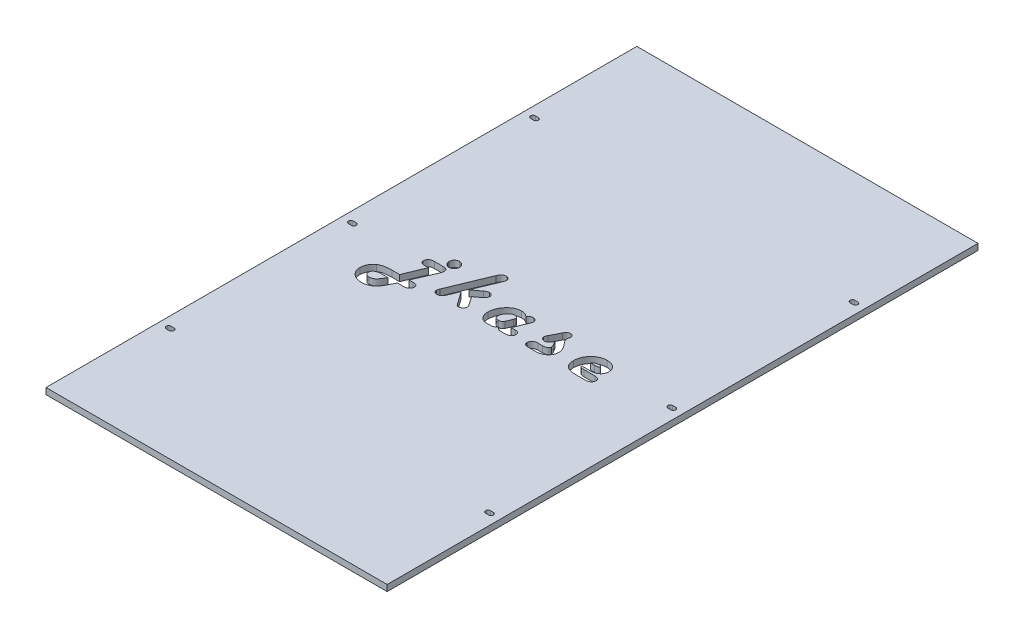
from build123d import *

# Parameters (mm, degrees)
SKETCH_1_W              = 220
SKETCH_1_H              = 381
EXTRUDE_1_DEPTH         = 4
HOLE_WIZARD_2_9_2_9_1_D = 2.9
CUT_EXTRUDE_3_DEPTH     = 225.945898173
CUT_EXTRUDE_4_DEPTH     = 225.945898311


with BuildPart() as part:
    # 草圖1 → 填料-伸長1 (new body)
    with BuildSketch(Plane(origin=(0, 0, 0), x_dir=(1, 0, 0), z_dir=(0, 1, 0))):
        with Locations((-3.755314961, 3.521610711)):
            Rectangle(SKETCH_1_W, SKETCH_1_H)
    extrude(amount=-EXTRUDE_1_DEPTH)

    # Ø2.9 (2.9) 直徑孔1 (through all)
    with Locations(Plane(origin=(-106.755314961, 0, -121.021610711), x_dir=(0, 0, 1), z_dir=(0, 1, 0))):
        with Locations((0, 0), (117.5, 0), (235, 0), (235, 206), (117.5, 206), (0, 206)):
            Hole(HOLE_WIZARD_2_9_2_9_1_D / 2)

    # 草圖6 → 除料-伸長3 (cut, through all)
    # profile 1 of 6: a face of its own
    with BuildSketch(Plane(origin=(0, 0, 0), x_dir=(1, 0, 0), z_dir=(0, 1, 0))):
        with BuildLine():
            Line((-56.707883455, -9.882498878), (-54.080314961, -9.882498878))
            add(Edge.make_bspline(
                [(-54.080314961, -9.882498878), (-53.846803536, -9.888460143), (-53.405322462, -9.899730623), (-52.791394229, -10.003113139), (-52.2675506, -10.172191342), (-51.829005076, -10.408457443), (-51.497746899, -10.740338804), (-51.246306857, -11.12720908), (-51.113141152, -11.595486832), (-51.09504868, -11.925398642), (-51.085451948, -12.100392714)],
                knots=[0, 0, 0, 0, 1.320440897, 2.496450283, 3.507428571, 4.426081598, 5.28328365, 6.133314078, 7.00985972, 8, 8, 8, 8], degree=3))
            add(Edge.make_bspline(
                [(-51.085451948, -12.100392714), (-51.096078388, -12.337305993), (-51.116579449, -12.794370941), (-51.31951434, -13.440270308), (-51.664616797, -14.00189006), (-52.135919876, -14.477306248), (-52.72884569, -14.857167097), (-53.430876539, -15.122864276), (-54.238585193, -15.27605282), (-54.809494192, -15.296393865), (-55.111564961, -15.307156412)],
                knots=[0, 0, 0, 0, 0.975863685, 1.882685037, 2.759476257, 3.673560596, 4.622529859, 5.644125856, 6.753495364, 8, 8, 8, 8], degree=3))
            Line((-55.111564961, -15.307156412), (-58.826890304, -15.307156412))
            Line((-58.826890304, -15.307156412), (-60.536222496, -18.690504015))
            Line((-60.536222496, -18.690504015), (-61.235494756, -20.08198518))
            add(Edge.make_bspline(
                [(-61.235494756, -20.08198518), (-61.373677856, -20.347397447), (-61.645594273, -20.869675153), (-62.098440226, -21.608918538), (-62.57288592, -22.297156683), (-63.068040173, -22.93392772), (-63.58339549, -23.524944882), (-64.128803742, -24.057626274), (-64.685515384, -24.552582027), (-65.275570331, -24.981539696), (-65.883717001, -25.365380339), (-66.514604477, -25.6972031), (-67.166306364, -25.985036149), (-67.847805041, -26.205257232), (-68.546389878, -26.39388346), (-69.26971669, -26.520037031), (-70.013892883, -26.58900615), (-70.516608631, -26.601966988), (-70.771025578, -26.608526275)],
                knots=[0, 0, 0, 0, 1.173928715, 2.310054478, 3.399266196, 4.452701399, 5.47396114, 6.473551042, 7.44265858, 8.394344937, 9.332571238, 10.262481144, 11.189356778, 12.124301921, 13.070004608, 14.026968462, 15.00147815, 16, 16, 16, 16], degree=3))
            add(Edge.make_bspline(
                [(-70.771025578, -26.608526275), (-71.077434087, -26.602089685), (-71.678022298, -26.58947339), (-72.55939026, -26.480017179), (-73.401556858, -26.305992848), (-74.205087801, -26.056163693), (-74.973971692, -25.739449149), (-75.700444469, -25.338732734), (-76.397073185, -24.881230714), (-77.043838304, -24.351697497), (-77.633163068, -23.770384898), (-78.153146042, -23.148508164), (-78.58742741, -22.486157125), (-78.93891688, -21.78991513), (-79.229509075, -21.064685468), (-79.424245706, -20.300044393), (-79.538433266, -19.499176806), (-79.555953783, -18.954580208), (-79.564904002, -18.676377303)],
                knots=[0, 0, 0, 0, 1.112220966, 2.18005303, 3.219619084, 4.230960223, 5.231219529, 6.233522715, 7.23888393, 8.25365207, 9.26322105, 10.240715656, 11.191564732, 12.132134891, 13.068811624, 14.022653815, 14.989888192, 16, 16, 16, 16], degree=3))
            add(Edge.make_bspline(
                [(-79.564904002, -18.676377303), (-79.551964535, -18.345951882), (-79.525982135, -17.682458933), (-79.33594934, -16.694712429), (-79.021662069, -15.718103744), (-78.583393185, -14.769266558), (-78.058609389, -13.866444494), (-77.435605138, -13.052041346), (-76.738409567, -12.331336262), (-76.210549284, -11.931578623), (-75.948465646, -11.733098193)],
                knots=[0, 0, 0, 0, 0.976706833, 1.96122349, 2.963017113, 4.003613299, 5.04600127, 6.044402259, 7.029041992, 8, 8, 8, 8], degree=3))
            add(Edge.make_bspline(
                [(-75.948465646, -11.733098193), (-75.715855366, -11.584543192), (-75.234543655, -11.277156683), (-74.431028686, -10.89843597), (-73.537151114, -10.585157246), (-72.557935218, -10.321121141), (-71.486516214, -10.131141317), (-70.327361165, -9.979715505), (-69.076990816, -9.898246966), (-68.214195323, -9.8878582), (-67.769099208, -9.882498878)],
                knots=[0, 0, 0, 0, 0.778053811, 1.609930613, 2.498631059, 3.447639707, 4.467720787, 5.565947943, 6.744329191, 8, 8, 8, 8], degree=3))
            Line((-67.769099208, -9.882498878), (-62.810623181, -9.882498878))
            Line((-62.810623181, -9.882498878), (-57.400092359, 3.227090163))
            Line((-57.400092359, 3.227090163), (-59.971154002, 3.227090163))
            add(Edge.make_bspline(
                [(-59.971154002, 3.227090163), (-60.19537031, 3.232838927), (-60.618379044, 3.243684603), (-61.205407651, 3.349443603), (-61.710801774, 3.513769097), (-62.120638997, 3.766626746), (-62.4526551, 4.082355204), (-62.681437787, 4.476857816), (-62.821001246, 4.938960787), (-62.832683469, 5.26966607), (-62.838876605, 5.444983998)],
                knots=[0, 0, 0, 0, 1.300564961, 2.453658901, 3.45240791, 4.366849035, 5.227268409, 6.085403913, 6.985008596, 8, 8, 8, 8], degree=3))
            add(Edge.make_bspline(
                [(-62.838876605, 5.444983998), (-62.827656622, 5.684119008), (-62.806039611, 6.1448491), (-62.612842862, 6.794248277), (-62.284226962, 7.357472653), (-61.829542444, 7.82753243), (-61.262085375, 8.21124101), (-60.575959757, 8.462815331), (-59.795757756, 8.632346571), (-59.239960793, 8.645050634), (-58.946967359, 8.651747697)],
                knots=[0, 0, 0, 0, 1.00337913, 1.933163031, 2.815671856, 3.718527641, 4.659876397, 5.668705541, 6.771036881, 8, 8, 8, 8], degree=3))
            Line((-58.946967359, 8.651747697), (-53.246838934, 8.651747697))
            add(Edge.make_bspline(
                [(-53.246838934, 8.651747697), (-53.006265612, 8.646367101), (-52.554989093, 8.636273976), (-51.924392199, 8.526813509), (-51.390385027, 8.333037773), (-50.939389373, 8.077402883), (-50.594662806, 7.722471833), (-50.349997918, 7.295407538), (-50.207013744, 6.791125724), (-50.190211126, 6.432456331), (-50.181342359, 6.243143245)],
                knots=[0, 0, 0, 0, 1.296879226, 2.432735008, 3.433078365, 4.349978554, 5.203100014, 6.067862313, 6.980177973, 8, 8, 8, 8], degree=3))
            add(Edge.make_bspline(
                [(-50.181342359, 6.243143245), (-50.189800752, 6.082699819), (-50.207457506, 5.747776847), (-50.303686189, 5.226268331), (-50.466623754, 4.670926976), (-50.618216377, 4.297130288), (-50.696967359, 4.102946327)],
                knots=[0, 0, 0, 0, 0.869779632, 1.815650453, 2.865250387, 4, 4, 4, 4], degree=3))
            Line((-50.696967359, 4.102946327), (-56.707883455, -9.882498878))
        make_face()
        with BuildLine():
            Line((-64.92963003, -15.307156412), (-68.270597496, -15.307156412))
            add(Edge.make_bspline(
                [(-68.270597496, -15.307156412), (-68.508397548, -15.310651611), (-68.967785893, -15.317403726), (-69.633313782, -15.346871955), (-70.252115541, -15.423561955), (-70.826804183, -15.507886033), (-71.353632667, -15.632841028), (-71.838735538, -15.76831221), (-72.273919274, -15.94690334), (-72.668489337, -16.143953287), (-73.014426171, -16.369268983), (-73.316503408, -16.619478638), (-73.574437143, -16.894899485), (-73.780081284, -17.204277887), (-73.946363589, -17.537766057), (-74.055226717, -17.901246518), (-74.131305435, -18.287082805), (-74.137211082, -18.553546791), (-74.140246468, -18.690504015)],
                knots=[0, 0, 0, 0, 1.499319777, 2.896425055, 4.196166997, 5.428397356, 6.555302654, 7.607295001, 8.599480653, 9.515475966, 10.384072422, 11.195501791, 11.983238689, 12.75301387, 13.529626568, 14.322936488, 15.138022488, 16, 16, 16, 16], degree=3))
            add(Edge.make_bspline(
                [(-74.140246468, -18.690504015), (-74.131003719, -18.865699472), (-74.112911347, -19.208638709), (-73.962898326, -19.70005514), (-73.697919379, -20.131372485), (-73.350140143, -20.509241977), (-72.91890562, -20.813023447), (-72.419175743, -21.022906158), (-71.86660208, -21.165212141), (-71.475977575, -21.177479424), (-71.272523865, -21.183868741)],
                knots=[0, 0, 0, 0, 0.986072637, 1.930204145, 2.858450967, 3.816001337, 4.806081511, 5.804216648, 6.856343462, 8, 8, 8, 8], degree=3))
            add(Edge.make_bspline(
                [(-71.272523865, -21.183868741), (-70.976403709, -21.170351611), (-70.387568059, -21.143472766), (-69.538565444, -20.88344272), (-68.742762449, -20.470447742), (-68.133226609, -19.994963375), (-67.66076104, -19.530330686), (-67.294327953, -19.111133462), (-66.919809849, -18.629743219), (-66.542475031, -18.083112263), (-66.141570961, -17.482523691), (-65.745163649, -16.811854635), (-65.332222672, -16.083474765), (-65.066856501, -15.571769862), (-64.92963003, -15.307156412)],
                knots=[0, 0, 0, 0, 1.165182134, 2.316967503, 3.467367141, 4.685724863, 5.348912398, 6.079174134, 6.87972837, 7.75301661, 8.698185743, 9.726916567, 10.824540386, 12, 12, 12, 12], degree=3))
        make_face(mode=Mode.SUBTRACT)
    # profile 2 of 6: a face of its own
    with BuildSketch(Plane(origin=(0, 0, 0), x_dir=(1, 0, 0), z_dir=(0, 1, 0))):
        with BuildLine():
            add(Edge.make_bspline(
                [(-50.85942455, 16.788733998), (-50.632184176, 16.776421407), (-50.186425637, 16.752268821), (-49.544250105, 16.563920937), (-48.961770875, 16.242801426), (-48.442344395, 15.815403195), (-48.014946164, 15.295976715), (-47.693826653, 14.713497485), (-47.505478769, 14.071321953), (-47.481326183, 13.625563414), (-47.469013592, 13.39832304)],
                knots=[0, 0, 0, 0, 1.022434278, 2.00562427, 2.98307932, 4, 5.01692068, 5.99437573, 6.977565722, 8, 8, 8, 8], degree=3))
            add(Edge.make_bspline(
                [(-47.469013592, 13.39832304), (-47.481326183, 13.171082665), (-47.505478769, 12.725324126), (-47.693826653, 12.083148594), (-48.014946164, 11.500669364), (-48.442344395, 10.981242884), (-48.961770875, 10.553844654), (-49.544250105, 10.232725142), (-50.186425637, 10.044377258), (-50.632184176, 10.020224672), (-50.85942455, 10.007912081)],
                knots=[0, 0, 0, 0, 1.022434278, 2.00562427, 2.98307932, 4, 5.01692068, 5.99437573, 6.977565722, 8, 8, 8, 8], degree=3))
            add(Edge.make_bspline(
                [(-50.85942455, 10.007912081), (-51.086664925, 10.020224672), (-51.532423464, 10.044377258), (-52.174598996, 10.232725142), (-52.757078226, 10.553844654), (-53.276504706, 10.981242884), (-53.703902936, 11.500669364), (-54.025022448, 12.083148594), (-54.213370332, 12.725324126), (-54.237522918, 13.171082665), (-54.249835509, 13.39832304)],
                knots=[0, 0, 0, 0, 1.022434278, 2.00562427, 2.98307932, 4, 5.01692068, 5.99437573, 6.977565722, 8, 8, 8, 8], degree=3))
            add(Edge.make_bspline(
                [(-54.249835509, 13.39832304), (-54.237522918, 13.625563414), (-54.213370332, 14.071321953), (-54.025022448, 14.713497485), (-53.703902936, 15.295976715), (-53.276504706, 15.815403195), (-52.757078226, 16.242801426), (-52.174598996, 16.563920937), (-51.532423464, 16.752268821), (-51.086664925, 16.776421407), (-50.85942455, 16.788733998)],
                knots=[0, 0, 0, 0, 1.022434278, 2.00562427, 2.98307932, 4, 5.01692068, 5.99437573, 6.977565722, 8, 8, 8, 8], degree=3))
        make_face()
    # profile 3 of 6: a face of its own
    with BuildSketch(Plane(origin=(0, 0, 0), x_dir=(1, 0, 0), z_dir=(0, 1, 0))):
        with BuildLine():
            Line((-27.250862907, 1.02332304), (-23.493157427, -4.535538262))
            add(Edge.make_bspline(
                [(-23.493157427, -4.535538262), (-23.385613297, -4.698135548), (-23.186740075, -4.998814408), (-22.96613677, -5.449295979), (-22.816074697, -5.851659984), (-22.795983075, -6.112024296), (-22.786821811, -6.230743741)],
                knots=[0, 0, 0, 0, 1.255887376, 2.322417502, 3.235065423, 4, 4, 4, 4], degree=3))
            add(Edge.make_bspline(
                [(-22.786821811, -6.230743741), (-22.796902135, -6.4042314), (-22.817056241, -6.751094088), (-23.007710178, -7.250046629), (-23.30665477, -7.716901219), (-23.702320245, -8.14367469), (-24.169504873, -8.507574965), (-24.679154264, -8.781161053), (-25.225768719, -8.944001947), (-25.599330085, -8.966819445), (-25.788748181, -8.978389289)],
                knots=[0, 0, 0, 0, 0.928583691, 1.856564545, 2.828310101, 3.893239512, 4.965649554, 5.995080196, 6.983384995, 8, 8, 8, 8], degree=3))
            add(Edge.make_bspline(
                [(-25.788748181, -8.978389289), (-25.953589567, -8.967243453), (-26.283917914, -8.94490813), (-26.747745502, -8.724473404), (-27.186108931, -8.402300124), (-27.41779542, -8.104701293), (-27.540460509, -7.947139289)],
                knots=[0, 0, 0, 0, 0.931433446, 1.866514693, 2.870438376, 4, 4, 4, 4], degree=3))
            Line((-27.540460509, -7.947139289), (-27.830058112, -7.537464632))
            Line((-27.830058112, -7.537464632), (-33.403046126, 0.387620985))
            Line((-33.403046126, 0.387620985), (-36.058868044, -5.941146139))
            add(Edge.make_bspline(
                [(-36.058868044, -5.941146139), (-36.166821887, -6.181496198), (-36.373120914, -6.640803453), (-36.750768974, -7.263210116), (-37.165877611, -7.788532786), (-37.619226039, -8.22185996), (-38.106605546, -8.570900879), (-38.645527199, -8.800525284), (-39.215106565, -8.951008616), (-39.608392296, -8.969124973), (-39.809510167, -8.978389289)],
                knots=[0, 0, 0, 0, 1.228664961, 2.347969998, 3.387825304, 4.343721817, 5.267244801, 6.167534526, 7.062916538, 8, 8, 8, 8], degree=3))
            add(Edge.make_bspline(
                [(-39.809510167, -8.978389289), (-39.972508185, -8.969304167), (-40.290759885, -8.951565574), (-40.751451816, -8.840259249), (-41.165192458, -8.636014776), (-41.534773109, -8.36962343), (-41.837411473, -8.039614741), (-42.059417768, -7.666919446), (-42.20450585, -7.260562377), (-42.218205403, -6.975974065), (-42.225177975, -6.831129015)],
                knots=[0, 0, 0, 0, 1.089189128, 2.126628872, 3.1394618, 4.152294729, 5.154079579, 6.106120088, 7.03608434, 8, 8, 8, 8], degree=3))
            add(Edge.make_bspline(
                [(-42.225177975, -6.831129015), (-42.221774258, -6.712962686), (-42.214559158, -6.462477186), (-42.126481204, -6.081643467), (-42.017358455, -5.667475623), (-41.903816193, -5.393735262), (-41.843756742, -5.248937234)],
                knots=[0, 0, 0, 0, 0.864121176, 1.831738591, 2.853073858, 4, 4, 4, 4], degree=3))
            Line((-41.843756742, -5.248937234), (-41.575349208, -4.61323518))
            Line((-41.575349208, -4.61323518), (-31.291102633, 20.292158656))
            Line((-31.291102633, 20.292158656), (-31.029758455, 20.927860711))
            add(Edge.make_bspline(
                [(-31.029758455, 20.927860711), (-30.935904391, 21.137607198), (-30.755530793, 21.540708857), (-30.413871304, 22.082977694), (-30.028441294, 22.541123032), (-29.606342255, 22.921674211), (-29.133613408, 23.206630054), (-28.630112838, 23.425842243), (-28.075594475, 23.544435433), (-27.694008653, 23.561033504), (-27.498080372, 23.569555916)],
                knots=[0, 0, 0, 0, 1.170115595, 2.248788727, 3.253647746, 4.214329002, 5.130195442, 6.055136286, 7.001394233, 8, 8, 8, 8], degree=3))
            add(Edge.make_bspline(
                [(-27.498080372, 23.569555916), (-27.334692871, 23.561942479), (-27.014469603, 23.5470209), (-26.557114426, 23.414059289), (-26.132986627, 23.204872686), (-25.760721534, 22.909662392), (-25.443845559, 22.563178603), (-25.208052354, 22.171047224), (-25.069397764, 21.739896941), (-25.054581957, 21.439750665), (-25.047095783, 21.288091875)],
                knots=[0, 0, 0, 0, 1.052880146, 2.063540459, 3.049313818, 4.0892747, 5.111869003, 6.066075102, 7.022820756, 8, 8, 8, 8], degree=3))
            add(Edge.make_bspline(
                [(-25.047095783, 21.288091875), (-25.050581262, 21.165260859), (-25.057951397, 20.90553153), (-25.144661032, 20.507132793), (-25.263662518, 20.076450724), (-25.376298803, 19.787397859), (-25.435580372, 19.635266533)],
                knots=[0, 0, 0, 0, 0.861683695, 1.822052244, 2.853724972, 4, 4, 4, 4], degree=3))
            Line((-25.435580372, 19.635266533), (-25.711051263, 18.985437766))
            Line((-25.711051263, 18.985437766), (-31.947994756, 3.926362423))
            Line((-31.947994756, 3.926362423), (-26.608097496, 7.874778519))
            add(Edge.make_bspline(
                [(-26.608097496, 7.874778519), (-26.343281477, 8.059463884), (-25.849364377, 8.403926656), (-25.105562923, 8.802123189), (-24.412419923, 9.047922923), (-23.963249116, 9.086072751), (-23.754501605, 9.103802492)],
                knots=[0, 0, 0, 0, 1.227777704, 2.28996874, 3.205280566, 4, 4, 4, 4], degree=3))
            add(Edge.make_bspline(
                [(-23.754501605, 9.103802492), (-23.593486397, 9.096048928), (-23.283107124, 9.081102854), (-22.840060744, 8.954198825), (-22.435894427, 8.75616431), (-22.086480946, 8.47204784), (-21.797355152, 8.134166033), (-21.577372599, 7.755818479), (-21.454953113, 7.331175618), (-21.438920555, 7.037346977), (-21.430657427, 6.885908656)],
                knots=[0, 0, 0, 0, 1.077191635, 2.076437133, 3.064405517, 4.074802271, 5.070928044, 6.031939203, 6.985667898, 8, 8, 8, 8], degree=3))
            add(Edge.make_bspline(
                [(-21.430657427, 6.885908656), (-21.43673673, 6.75376678), (-21.448783403, 6.491916008), (-21.526317224, 6.101935158), (-21.673944296, 5.727764169), (-21.862249771, 5.356710551), (-22.116373659, 5.003949651), (-22.414408563, 4.6520672), (-22.776688489, 4.316619129), (-23.044296322, 4.105779576), (-23.182369756, 3.996995985)],
                knots=[0, 0, 0, 0, 0.904161073, 1.791674836, 2.703974593, 3.647578222, 4.630492943, 5.669839074, 6.797743255, 8, 8, 8, 8], degree=3))
            Line((-23.182369756, 3.996995985), (-23.726248181, 3.60144804))
            Line((-23.726248181, 3.60144804), (-27.250862907, 1.02332304))
        make_face()
    # profile 4 of 6: a face of its own
    with BuildSketch(Plane(origin=(0, 0, 0), x_dir=(1, 0, 0), z_dir=(0, 1, 0))):
        with BuildLine():
            Line((2.785352847, -3.553731755), (5.41292134, -3.553731755))
            add(Edge.make_bspline(
                [(5.41292134, -3.553731755), (5.632134264, -3.560639635), (6.044825996, -3.573644457), (6.626502504, -3.665462482), (7.116151272, -3.844522247), (7.531871816, -4.074534148), (7.84253115, -4.398096135), (8.067829212, -4.784892722), (8.20553454, -5.242288661), (8.21771883, -5.570488052), (8.224137093, -5.743372166)],
                knots=[0, 0, 0, 0, 1.294214641, 2.436497235, 3.45633191, 4.35958604, 5.214514041, 6.067746316, 6.982155433, 8, 8, 8, 8], degree=3))
            add(Edge.make_bspline(
                [(8.224137093, -5.743372166), (8.213020111, -5.984808175), (8.19170176, -6.447795118), (7.998178188, -7.103631585), (7.661324686, -7.666942164), (7.211155177, -8.148682975), (6.642843691, -8.522560537), (5.977290495, -8.796519101), (5.212212378, -8.945542577), (4.671881865, -8.967095172), (4.388734696, -8.978389289)],
                knots=[0, 0, 0, 0, 1.02006706, 1.956119682, 2.85821293, 3.77438774, 4.72208319, 5.713685443, 6.801912016, 8, 8, 8, 8], degree=3))
            Line((4.388734696, -8.978389289), (1.337364833, -8.978389289))
            add(Edge.make_bspline(
                [(1.337364833, -8.978389289), (1.172240085, -8.972898344), (0.856500454, -8.962398955), (0.402021366, -8.884438892), (-0.012355855, -8.74966087), (-0.387962692, -8.560641452), (-0.718604304, -8.313274524), (-1.012869104, -8.021578276), (-1.263925187, -7.67049678), (-1.388499293, -7.405528367), (-1.452660852, -7.269057097)],
                knots=[0, 0, 0, 0, 1.135602606, 2.17141737, 3.159933094, 4.123316935, 5.049777826, 5.988893951, 6.964185235, 8, 8, 8, 8], degree=3))
            add(Edge.make_bspline(
                [(-1.452660852, -7.269057097), (-1.738754288, -7.529639333), (-2.277816428, -8.02063283), (-3.166990112, -8.551017267), (-4.03646661, -8.914697661), (-4.627998013, -8.957645601), (-4.913705372, -8.978389289)],
                knots=[0, 0, 0, 0, 1.172355213, 2.208971714, 3.134940325, 4, 4, 4, 4], degree=3))
            Line((-4.913705372, -8.978389289), (-7.626034139, -8.978389289))
            add(Edge.make_bspline(
                [(-7.626034139, -8.978389289), (-7.840617532, -8.973357852), (-8.259761168, -8.963529995), (-8.872202348, -8.87501596), (-9.454718624, -8.738689116), (-10.000619234, -8.527284033), (-10.519810249, -8.275852706), (-11.006358483, -7.960696868), (-11.455296087, -7.584919069), (-11.875025091, -7.161624668), (-12.245375429, -6.68621648), (-12.581535042, -6.179850707), (-12.856042055, -5.630386312), (-13.083364205, -5.048808743), (-13.25783849, -4.433496251), (-13.388604193, -3.784531139), (-13.455026421, -3.09834655), (-13.467905992, -2.628548636), (-13.474493044, -2.388277988)],
                knots=[0, 0, 0, 0, 1.038881097, 2.029236264, 2.991883691, 3.930308829, 4.858629969, 5.782385855, 6.730121337, 7.689859128, 8.664191716, 9.644845373, 10.629272188, 11.633194497, 12.665607055, 13.723595041, 14.835769002, 16, 16, 16, 16], degree=3))
            add(Edge.make_bspline(
                [(-13.474493044, -2.388277988), (-13.46533472, -2.020454677), (-13.447235287, -1.293532016), (-13.292131143, -0.217633211), (-13.047430317, 0.828323769), (-12.698442972, 1.845436788), (-12.248769862, 2.828665027), (-11.713965201, 3.789273417), (-11.060863463, 4.709005327), (-10.33142843, 5.594458471), (-9.537504971, 6.40937661), (-8.709829822, 7.131618819), (-7.846935082, 7.733473152), (-6.967738936, 8.242019658), (-6.052403794, 8.624753309), (-5.115506215, 8.903853964), (-4.149661921, 9.06960656), (-3.496944535, 9.092368291), (-3.1690564, 9.103802492)],
                knots=[0, 0, 0, 0, 1.038393463, 2.052158511, 3.063456151, 4.068635755, 5.08344709, 6.113632118, 7.168837633, 8.264602753, 9.350863708, 10.378663772, 11.361961956, 12.31789787, 13.241700555, 14.156967694, 15.07416527, 16, 16, 16, 16], degree=3))
            add(Edge.make_bspline(
                [(-3.1690564, 9.103802492), (-2.924076979, 9.097745769), (-2.44931253, 9.086007981), (-1.759446698, 9.013724371), (-1.124122233, 8.865498456), (-0.531045107, 8.691443642), (0.001458044, 8.437553209), (0.487277887, 8.140583713), (0.925158302, 7.788400307), (1.167156531, 7.506762895), (1.28792134, 7.366216875)],
                knots=[0, 0, 0, 0, 1.187749171, 2.30183041, 3.353985773, 4.346587157, 5.291117026, 6.203238886, 7.103359092, 8, 8, 8, 8], degree=3))
            add(Edge.make_bspline(
                [(1.28792134, 7.366216875), (1.388561151, 7.505126892), (1.584063823, 7.774973183), (1.918754051, 8.130497187), (2.276712926, 8.431156677), (2.655631879, 8.68256156), (3.067219099, 8.862156337), (3.489862363, 9.010874295), (3.943472907, 9.086051307), (4.251956896, 9.097790903), (4.409924765, 9.103802492)],
                knots=[0, 0, 0, 0, 1.102961423, 2.142610407, 3.131917189, 4.106850711, 5.056016811, 6.014208465, 6.983119812, 8, 8, 8, 8], degree=3))
            add(Edge.make_bspline(
                [(4.409924765, 9.103802492), (4.57769441, 9.095202009), (4.90593731, 9.078375083), (5.376708924, 8.960739309), (5.797874647, 8.746047993), (6.16780494, 8.465902789), (6.483228728, 8.131082759), (6.703610815, 7.740026888), (6.847953995, 7.312597349), (6.861185695, 7.011895846), (6.86797271, 6.857655231)],
                knots=[0, 0, 0, 0, 1.085152088, 2.123110344, 3.11068521, 4.121931818, 5.11360817, 6.061884541, 7.005870879, 8, 8, 8, 8], degree=3))
            add(Edge.make_bspline(
                [(6.86797271, 6.857655231), (6.863838932, 6.74433025), (6.855069286, 6.503915759), (6.778572897, 6.129996719), (6.658567107, 5.725567493), (6.545716347, 5.453446537), (6.486551477, 5.310780231)],
                knots=[0, 0, 0, 0, 0.847236183, 1.797378234, 2.845219729, 4, 4, 4, 4], degree=3))
            Line((6.486551477, 5.310780231), (6.225207299, 4.682141533))
            Line((6.225207299, 4.682141533), (2.785352847, -3.553731755))
        make_face()
        with BuildLine():
            Line((-5.867258455, -3.553731755), (-5.266873181, -3.553731755))
            add(Edge.make_bspline(
                [(-5.266873181, -3.553731755), (-5.115919276, -3.550422156), (-4.823974845, -3.544021402), (-4.405266317, -3.473704183), (-4.027825432, -3.352996934), (-3.68777306, -3.189429537), (-3.390101726, -2.975905525), (-3.129990225, -2.717724536), (-2.915140715, -2.407553608), (-2.80773948, -2.175859068), (-2.752318386, -2.056300248)],
                knots=[0, 0, 0, 0, 1.157664044, 2.238919033, 3.244614913, 4.190073881, 5.122668863, 6.042574887, 6.989931157, 8, 8, 8, 8], degree=3))
            Line((-2.752318386, -2.056300248), (-1.141873181, 1.81441893))
            add(Edge.make_bspline(
                [(-1.141873181, 1.81441893), (-1.045653008, 2.044167143), (-0.874527911, 2.452768418), (-0.834485967, 2.893086769), (-0.816958797, 3.08582304)],
                knots=[0, 0, 0, 0, 1.124559448, 2, 2, 2, 2], degree=3))
            add(Edge.make_bspline(
                [(-0.816958797, 3.08582304), (-0.82655903, 3.183149666), (-0.845925793, 3.37948884), (-0.961135597, 3.667622233), (-1.181800771, 3.913268763), (-1.453213944, 4.144540837), (-1.781947759, 4.340399842), (-2.152572448, 4.480608053), (-2.555159861, 4.568735704), (-2.834251168, 4.578310887), (-2.978345783, 4.583254546)],
                knots=[0, 0, 0, 0, 0.81058345, 1.635208074, 2.524363624, 3.523748651, 4.593951107, 5.683817953, 6.804157088, 8, 8, 8, 8], degree=3))
            add(Edge.make_bspline(
                [(-2.978345783, 4.583254546), (-3.124819663, 4.578307429), (-3.420642127, 4.568316101), (-3.859336261, 4.470354364), (-4.293305325, 4.321865901), (-4.723940205, 4.111578521), (-5.151489407, 3.843171913), (-5.579050439, 3.516458312), (-5.993621651, 3.122564832), (-6.537628723, 2.544761814), (-7.125193989, 1.765966075), (-7.6521336, 0.781486963), (-7.986268445, -0.2268583), (-8.028791234, -0.912003412), (-8.049835509, -1.251077645)],
                knots=[0, 0, 0, 0, 0.627706518, 1.267732443, 1.919531944, 2.592823818, 3.31892668, 4.082778462, 4.897707917, 5.769757387, 7.487317347, 9.064628885, 10.547302323, 12, 12, 12, 12], degree=3))
            add(Edge.make_bspline(
                [(-8.049835509, -1.251077645), (-8.043058621, -1.430470575), (-8.030191503, -1.771079708), (-7.935117741, -2.248203402), (-7.767069149, -2.656238023), (-7.516669726, -2.986540226), (-7.199311108, -3.244864557), (-6.813676955, -3.432988361), (-6.359888681, -3.535717572), (-6.037289328, -3.547514176), (-5.867258455, -3.553731755)],
                knots=[0, 0, 0, 0, 1.183693291, 2.247450585, 3.194323595, 4.070859252, 4.954393584, 5.871857821, 6.878330445, 8, 8, 8, 8], degree=3))
        make_face(mode=Mode.SUBTRACT)
    # profile 5 of 6: a face of its own
    with BuildSketch(Plane(origin=(0, 0, 0), x_dir=(1, 0, 0), z_dir=(0, 1, 0))):
        with BuildLine():
            Line((24.550378532, 2.789162081), (24.084197025, 1.779102149))
            add(Edge.make_bspline(
                [(24.084197025, 1.779102149), (23.99399979, 1.607192918), (23.820546809, 1.276604415), (23.50468656, 0.835237157), (23.167575147, 0.455684595), (22.794565808, 0.148513537), (22.39690241, -0.096573635), (21.966900829, -0.267712895), (21.508350979, -0.368331619), (21.193431642, -0.382250008), (21.032827162, -0.389348193)],
                knots=[0, 0, 0, 0, 1.174117443, 2.257875999, 3.277186543, 4.239058904, 5.172954822, 6.09414408, 7.028039998, 8, 8, 8, 8], degree=3))
            add(Edge.make_bspline(
                [(21.032827162, -0.389348193), (20.869689728, -0.380697738), (20.546020291, -0.363534982), (20.073163497, -0.240941198), (19.630674026, -0.031019571), (19.226493084, 0.247032025), (18.884712951, 0.577885848), (18.627291041, 0.944983071), (18.469132765, 1.34316333), (18.450070076, 1.620018012), (18.44057545, 1.757912081)],
                knots=[0, 0, 0, 0, 1.057292043, 2.097698319, 3.142574676, 4.21811325, 5.26521749, 6.20945791, 7.108177862, 8, 8, 8, 8], degree=3))
            add(Edge.make_bspline(
                [(18.44057545, 1.757912081), (18.449686606, 1.902375201), (18.469722983, 2.220064563), (18.621350189, 2.719177062), (18.829401534, 3.28944284), (19.026869346, 3.676420598), (19.132784354, 3.883982286)],
                knots=[0, 0, 0, 0, 0.768398351, 1.68978755, 2.760880737, 4, 4, 4, 4], degree=3))
            Line((19.132784354, 3.883982286), (22.304231272, 10.050292218))
            add(Edge.make_bspline(
                [(22.304231272, 10.050292218), (22.402068083, 10.226585397), (22.58840766, 10.562352642), (22.910811093, 11.014529167), (23.250951029, 11.396304347), (23.601368824, 11.721918357), (23.98100679, 11.964393522), (24.37692872, 12.136411046), (24.789144513, 12.248331054), (25.072368615, 12.26155672), (25.214334011, 12.268186053)],
                knots=[0, 0, 0, 0, 1.254889241, 2.390056746, 3.44940031, 4.435704489, 5.358962696, 6.23882182, 7.117213696, 8, 8, 8, 8], degree=3))
            add(Edge.make_bspline(
                [(25.214334011, 12.268186053), (25.365780636, 12.262351449), (25.661445383, 12.250960723), (26.086637159, 12.133485361), (26.474243967, 11.939570439), (26.815328678, 11.675737918), (27.116619664, 11.375570233), (27.320043054, 11.019853617), (27.460035912, 10.642076575), (27.474362287, 10.376496772), (27.48167134, 10.241002834)],
                knots=[0, 0, 0, 0, 1.076175427, 2.100985328, 3.113101887, 4.142426693, 5.162150658, 6.116677772, 7.039163592, 8, 8, 8, 8], degree=3))
            add(Edge.make_bspline(
                [(27.48167134, 10.241002834), (27.478162189, 10.196068948), (27.469351791, 10.083253777), (27.412310238, 9.885779321), (27.328017223, 9.624346121), (27.254347501, 9.430737207), (27.213263806, 9.322766533)],
                knots=[0, 0, 0, 0, 0.562304537, 1.411773774, 2.556613312, 4, 4, 4, 4], degree=3))
            add(Edge.make_bspline(
                [(27.213263806, 9.322766533), (27.161687899, 9.159268117), (27.066452025, 8.857365246), (27.041195264, 8.542029502), (27.029616545, 8.397466875)],
                knots=[0, 0, 0, 0, 1.083119314, 2, 2, 2, 2], degree=3))
            add(Edge.make_bspline(
                [(27.029616545, 8.397466875), (27.045371732, 8.146160578), (27.077496476, 7.633748315), (27.324949254, 6.868225554), (27.704884181, 6.092777532), (28.0640605, 5.611490979), (28.251577162, 5.360223725)],
                knots=[0, 0, 0, 0, 0.903479948, 1.84219102, 2.873463769, 4, 4, 4, 4], degree=3))
            Line((28.251577162, 5.360223725), (29.734881956, 3.495497697))
            add(Edge.make_bspline(
                [(29.734881956, 3.495497697), (29.914433826, 3.259822761), (30.263018606, 2.802279792), (30.724753164, 2.096442523), (31.12363074, 1.401443578), (31.441948871, 0.705355082), (31.693784138, 0.016356586), (31.868598558, -0.667547923), (31.981841679, -1.346205056), (31.995451541, -1.796878253), (32.002219285, -2.020983467)],
                knots=[0, 0, 0, 0, 1.169686632, 2.270847738, 3.328397313, 4.331060642, 5.289870021, 6.221237339, 7.115478822, 8, 8, 8, 8], degree=3))
            add(Edge.make_bspline(
                [(32.002219285, -2.020983467), (31.99561792, -2.263881547), (31.982606685, -2.742631649), (31.874265209, -3.443779788), (31.697207009, -4.11414375), (31.447999391, -4.753631075), (31.12999919, -5.363639827), (30.736282646, -5.939709609), (30.27414742, -6.485812764), (29.748114057, -6.995473171), (29.171830223, -7.463775857), (28.546719713, -7.861776615), (27.897216768, -8.215708119), (27.204583224, -8.487161561), (26.482969241, -8.710325752), (25.72518352, -8.859937886), (24.9348639, -8.967431444), (24.395372912, -8.974681899), (24.119513806, -8.978389289)],
                knots=[0, 0, 0, 0, 0.993241798, 1.957671351, 2.894532395, 3.824635469, 4.759513946, 5.702543649, 6.673110019, 7.681185445, 8.695042061, 9.70491044, 10.708882264, 11.715852748, 12.742665798, 13.794825053, 14.872423076, 16, 16, 16, 16], degree=3))
            Line((24.119513806, -8.978389289), (19.13984771, -8.978389289))
            add(Edge.make_bspline(
                [(19.13984771, -8.978389289), (18.908833866, -8.971561366), (18.475015036, -8.958739269), (17.86591564, -8.866670461), (17.349998451, -8.689538192), (16.921365335, -8.449402165), (16.582440007, -8.137646687), (16.341477289, -7.750591362), (16.2083127, -7.289199166), (16.189969549, -6.961479268), (16.180301477, -6.788748878)],
                knots=[0, 0, 0, 0, 1.323532141, 2.485449164, 3.513452649, 4.431917301, 5.281225849, 6.123328076, 7.010867896, 8, 8, 8, 8], degree=3))
            add(Edge.make_bspline(
                [(16.180301477, -6.788748878), (16.19069878, -6.547093936), (16.210666718, -6.082997532), (16.414603672, -5.428282569), (16.755307948, -4.862802583), (17.226274511, -4.387975397), (17.814980906, -4.016044944), (18.501992085, -3.7350957), (19.293739123, -3.586557684), (19.850330603, -3.56504017), (20.142844285, -3.553731755)],
                knots=[0, 0, 0, 0, 1.001377246, 1.923137072, 2.813709682, 3.719614256, 4.674449185, 5.687788699, 6.784829692, 8, 8, 8, 8], degree=3))
            Line((20.142844285, -3.553731755), (22.904616545, -3.553731755))
            add(Edge.make_bspline(
                [(22.904616545, -3.553731755), (23.1923017, -3.548570846), (23.732562228, -3.538878877), (24.484712662, -3.427034292), (25.124781073, -3.248072177), (25.653275814, -2.994958958), (26.074068726, -2.664374663), (26.373531624, -2.24920389), (26.549942557, -1.754058828), (26.568062978, -1.400891904), (26.577561751, -1.215760865)],
                knots=[0, 0, 0, 0, 1.402558359, 2.633945154, 3.698995523, 4.63394819, 5.475307581, 6.281836869, 7.099334323, 8, 8, 8, 8], degree=3))
            add(Edge.make_bspline(
                [(26.577561751, -1.215760865), (26.566393352, -1.066502417), (26.542567309, -0.748082719), (26.38846509, -0.259136406), (26.154872043, 0.268988988), (25.937381189, 0.613947022), (25.821782641, 0.797295642)],
                knots=[0, 0, 0, 0, 0.822745714, 1.755200092, 2.806866562, 4, 4, 4, 4], degree=3))
            Line((25.821782641, 0.797295642), (24.550378532, 2.789162081))
        make_face()
    # profile 6 of 6: a face of its own
    with BuildSketch(Plane(origin=(0, 0, 0), x_dir=(1, 0, 0), z_dir=(0, 1, 0))):
        with BuildLine():
            add(Edge.make_bspline(
                [(47.014676477, -2.197567371), (47.02204935, -2.304986138), (47.036398053, -2.514038982), (47.173467091, -2.803510435), (47.396272858, -3.043871648), (47.702825035, -3.232682023), (48.087939659, -3.381557242), (48.555000334, -3.480753052), (49.106041316, -3.544299622), (49.500764565, -3.550434846), (49.712878532, -3.553731755)],
                knots=[0, 0, 0, 0, 0.764367135, 1.48757176, 2.238468815, 3.079136104, 4.038989023, 5.178564659, 6.483834326, 8, 8, 8, 8], degree=3))
            Line((49.712878532, -3.553731755), (56.790361408, -3.553731755))
            add(Edge.make_bspline(
                [(56.790361408, -3.553731755), (57.028659097, -3.559368137), (57.477319541, -3.569980165), (58.104058857, -3.677221529), (58.641753261, -3.840118595), (59.089877226, -4.080114612), (59.430149768, -4.408900092), (59.678722207, -4.800021862), (59.823614548, -5.265171699), (59.840079542, -5.596336664), (59.848794628, -5.771625591)],
                knots=[0, 0, 0, 0, 1.329951266, 2.503996275, 3.539647919, 4.458105728, 5.313878097, 6.153119145, 7.022427504, 8, 8, 8, 8], degree=3))
            add(Edge.make_bspline(
                [(59.848794628, -5.771625591), (59.839350511, -6.011290958), (59.821188247, -6.472198596), (59.603359235, -7.11797833), (59.267541047, -7.688134419), (58.781461516, -8.15844655), (58.177661148, -8.523403957), (57.469372321, -8.798652294), (56.650308239, -8.945264533), (56.070429509, -8.966990146), (55.766174765, -8.978389289)],
                knots=[0, 0, 0, 0, 0.976933495, 1.878770029, 2.756138518, 3.662236408, 4.614048262, 5.626718468, 6.754770387, 8, 8, 8, 8], degree=3))
            Line((55.766174765, -8.978389289), (49.020669628, -8.978389289))
            add(Edge.make_bspline(
                [(49.020669628, -8.978389289), (48.714368297, -8.973431077), (48.121708049, -8.963837468), (47.260121179, -8.876707641), (46.456315618, -8.739419653), (45.70708519, -8.54007023), (45.013252177, -8.287138466), (44.373936203, -7.978309404), (43.796204129, -7.604553595), (43.269537346, -7.183618829), (42.810743506, -6.696613166), (42.400553375, -6.16728877), (42.071638194, -5.572797981), (41.795066473, -4.934072218), (41.573789777, -4.243914039), (41.421820309, -3.500384037), (41.327701106, -2.703855875), (41.319023284, -2.155463755), (41.314548052, -1.872652988)],
                knots=[0, 0, 0, 0, 1.227108235, 2.374322919, 3.466320313, 4.491595847, 5.476620911, 6.421800553, 7.32994879, 8.228786483, 9.116312576, 10.005091494, 10.905017908, 11.830449113, 12.791227912, 13.803396435, 14.867191708, 16, 16, 16, 16], degree=3))
            add(Edge.make_bspline(
                [(41.314548052, -1.872652988), (41.323752098, -1.504858919), (41.341883514, -0.780326735), (41.494607607, 0.286894106), (41.744229032, 1.314302398), (42.079153291, 2.309870266), (42.531008044, 3.257124605), (43.069400773, 4.171404334), (43.71853197, 5.038116532), (44.445373985, 5.865479316), (45.241275399, 6.62399244), (46.092640241, 7.280281659), (46.973878899, 7.84609958), (47.895834134, 8.309395902), (48.85969841, 8.660450247), (49.85766391, 8.916678897), (50.891906544, 9.077999375), (51.595851069, 9.095134285), (51.951962436, 9.103802492)],
                knots=[0, 0, 0, 0, 1.040395912, 2.049517343, 3.043324832, 4.029374911, 5.015897555, 6.007693059, 7.027077414, 8.075019072, 9.12126503, 10.132759007, 11.112327862, 12.080685129, 13.046081227, 14.009175581, 14.992881997, 16, 16, 16, 16], degree=3))
            add(Edge.make_bspline(
                [(51.951962436, 9.103802492), (52.208697038, 9.09716911), (52.711353671, 9.084181716), (53.446864089, 9.01817377), (54.139584875, 8.886646351), (54.796701569, 8.721590767), (55.412497892, 8.492349373), (55.993077147, 8.218452819), (56.53370743, 7.892843091), (57.025443076, 7.515292724), (57.480278934, 7.111687277), (57.870726536, 6.660930136), (58.205033747, 6.181415015), (58.473297447, 5.667340865), (58.690438416, 5.126795881), (58.834786933, 4.549179934), (58.931235317, 3.941385896), (58.940149577, 3.524139881), (58.944685039, 3.311850437)],
                knots=[0, 0, 0, 0, 1.207786243, 2.364705663, 3.468027547, 4.520851029, 5.547315103, 6.552779455, 7.536484472, 8.5087175, 9.46512013, 10.391169545, 11.306498199, 12.207991695, 13.112743612, 14.039322501, 15.002432327, 16, 16, 16, 16], degree=3))
            add(Edge.make_bspline(
                [(58.944685039, 3.311850437), (58.936831915, 3.059396658), (58.92146104, 2.565270272), (58.793237309, 1.849834526), (58.580386796, 1.187587915), (58.287389593, 0.573930753), (57.901912897, 0.013477028), (57.432366042, -0.495868325), (56.88095652, -0.958143736), (56.46230055, -1.207364414), (56.246482984, -1.335837919)],
                knots=[0, 0, 0, 0, 1.069179242, 2.092698623, 3.067607365, 4.009120459, 4.963808814, 5.93825802, 6.937169971, 8, 8, 8, 8], degree=3))
            add(Edge.make_bspline(
                [(56.246482984, -1.335837919), (56.116244849, -1.407629567), (55.846778481, -1.556168509), (55.396230868, -1.716769036), (54.907682918, -1.870147782), (54.369992056, -1.983797225), (53.7891815, -2.088550051), (53.160550642, -2.144153005), (52.48712559, -2.191086193), (52.022698262, -2.195357665), (51.782441888, -2.197567371)],
                knots=[0, 0, 0, 0, 0.775768942, 1.605087792, 2.492325041, 3.450334938, 4.473645932, 5.574054255, 6.745015868, 8, 8, 8, 8], degree=3))
            Line((51.782441888, -2.197567371), (47.014676477, -2.197567371))
        make_face()
        with BuildLine():
            Line((48.158940176, 2.322980574), (50.786508669, 2.322980574))
            add(Edge.make_bspline(
                [(50.786508669, 2.322980574), (51.005587627, 2.324966756), (51.413607202, 2.328665883), (51.981503845, 2.373379761), (52.45974439, 2.42986276), (52.849542087, 2.519559763), (53.152830789, 2.636845048), (53.374479837, 2.778649676), (53.510451926, 2.965869556), (53.516856577, 3.102792899), (53.520027504, 3.170583314)],
                knots=[0, 0, 0, 0, 1.705094431, 3.175621766, 4.432939085, 5.451044315, 6.281582412, 6.952824954, 7.481546181, 8, 8, 8, 8], degree=3))
            add(Edge.make_bspline(
                [(53.520027504, 3.170583314), (53.509641992, 3.246762411), (53.489409083, 3.395173458), (53.395726148, 3.602254179), (53.238674012, 3.765383371), (53.042596289, 3.903584887), (52.79680887, 4.007294552), (52.504808571, 4.085090258), (52.162526374, 4.123784519), (51.919074244, 4.128624069), (51.789505244, 4.131199752)],
                knots=[0, 0, 0, 0, 0.838547182, 1.633645842, 2.4358048, 3.286135424, 4.243266486, 5.336598247, 6.582496278, 8, 8, 8, 8], degree=3))
            add(Edge.make_bspline(
                [(51.789505244, 4.131199752), (51.603151671, 4.126052844), (51.237859136, 4.115963812), (50.704774441, 4.028422572), (50.20088686, 3.889711754), (49.728459419, 3.686121743), (49.28248525, 3.436915796), (48.876376802, 3.115134903), (48.490547193, 2.751830267), (48.270677593, 2.467484624), (48.158940176, 2.322980574)],
                knots=[0, 0, 0, 0, 1.059074119, 2.076009944, 3.063613489, 4.023510937, 4.995010178, 5.959100355, 6.962817714, 8, 8, 8, 8], degree=3))
        make_face(mode=Mode.SUBTRACT)
    extrude(amount=-CUT_EXTRUDE_3_DEPTH, mode=Mode.SUBTRACT)


with BuildPart() as cut_extrude_3_piece_1:
    # of the separate pieces the step leaves, piece 1, a body of its own (cut_extrude_3_pieces)
    add(part.part.solids().sort_by_distance((-113.755314961, 0, -194.021610711))[0])

    # 草圖8 → 除料-伸長4 (cut, through all)
    with BuildSketch(Plane(origin=(0, 0, 0), x_dir=(1, 0, 0), z_dir=(0, 1, 0))):
        with BuildLine():
            Line((-107.755314961, 122.521610711), (-105.755314961, 122.521610711))
            ThreePointArc((-105.755314961, 122.521610711), (-104.255314961, 121.021610711), (-105.755314961, 119.521610711))
            Line((-105.755314961, 119.521610711), (-107.755314961, 119.521610711))
            ThreePointArc((-107.755314961, 119.521610711), (-109.255314961, 121.021610711), (-107.755314961, 122.521610711))
        make_face()
        with BuildLine():
            Line((98.244685039, 122.521610711), (100.244685039, 122.521610711))
            ThreePointArc((100.244685039, 122.521610711), (101.744685039, 121.021610711), (100.244685039, 119.521610711))
            Line((100.244685039, 119.521610711), (98.244685039, 119.521610711))
            ThreePointArc((98.244685039, 119.521610711), (96.744685039, 121.021610711), (98.244685039, 122.521610711))
        make_face()
        with BuildLine():
            Line((98.244685039, 5.021610711), (100.244685039, 5.021610711))
            ThreePointArc((100.244685039, 5.021610711), (101.744685039, 3.521610711), (100.244685039, 2.021610711))
            Line((100.244685039, 2.021610711), (98.244685039, 2.021610711))
            ThreePointArc((98.244685039, 2.021610711), (96.744685039, 3.521610711), (98.244685039, 5.021610711))
        make_face()
        with BuildLine():
            Line((98.244685039, -112.478389289), (100.244685039, -112.478389289))
            ThreePointArc((100.244685039, -112.478389289), (101.744685039, -113.978389289), (100.244685039, -115.478389289))
            Line((100.244685039, -115.478389289), (98.244685039, -115.478389289))
            ThreePointArc((98.244685039, -115.478389289), (96.744685039, -113.978389289), (98.244685039, -112.478389289))
        make_face()
        with BuildLine():
            Line((-107.755314961, 5.021610711), (-105.755314961, 5.021610711))
            ThreePointArc((-105.755314961, 5.021610711), (-104.255314961, 3.521610711), (-105.755314961, 2.021610711))
            Line((-105.755314961, 2.021610711), (-107.755314961, 2.021610711))
            ThreePointArc((-107.755314961, 2.021610711), (-109.255314961, 3.521610711), (-107.755314961, 5.021610711))
        make_face()
        with BuildLine():
            Line((-107.755314961, -112.478389289), (-105.755314961, -112.478389289))
            ThreePointArc((-105.755314961, -112.478389289), (-104.255314961, -113.978389289), (-105.755314961, -115.478389289))
            Line((-105.755314961, -115.478389289), (-107.755314961, -115.478389289))
            ThreePointArc((-107.755314961, -115.478389289), (-109.255314961, -113.978389289), (-107.755314961, -112.478389289))
        make_face()
    extrude(amount=-CUT_EXTRUDE_4_DEPTH, mode=Mode.SUBTRACT)


with BuildPart() as cut_extrude_3_piece_2:
    # of the separate pieces the step leaves, piece 2, a body of its own (cut_extrude_3_pieces)
    add(part.part.solids().sort_by_distance((-5.867258455, 0, 3.553731755))[0])


with BuildPart() as cut_extrude_3_piece_3:
    # of the separate pieces the step leaves, piece 3, a body of its own (cut_extrude_3_pieces)
    add(part.part.solids().sort_by_distance((-64.92963003, 0, 15.307156412))[0])


with BuildPart() as cut_extrude_3_piece_4:
    # of the separate pieces the step leaves, piece 4, a body of its own (cut_extrude_3_pieces)
    add(part.part.solids().sort_by_distance((48.158940176, 0, -2.322980574))[0])


solid = Compound([cut_extrude_3_piece_1.part, cut_extrude_3_piece_2.part, cut_extrude_3_piece_3.part, cut_extrude_3_piece_4.part])
